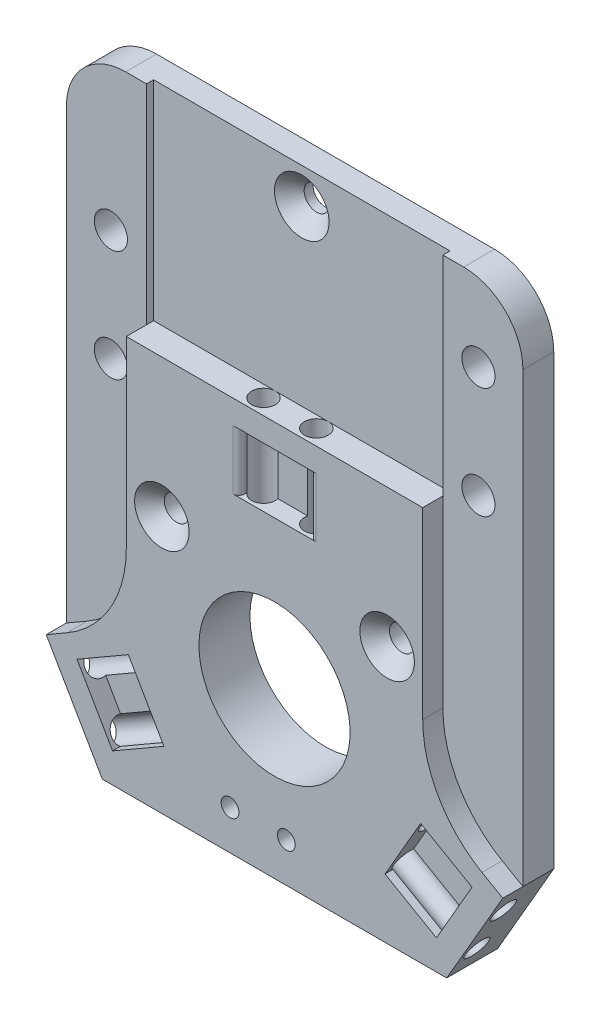
from build123d import *

# Parameters (mm, degrees)
BOSS_EXTRUDE1_DEPTH        = 2.6
BOSS_EXTRUDE1_DEPTH_BACK   = 6
FILLET1_R                  = 20
CUT_EXTRUDE1_DEPTH         = 5
SKETCH5_R                  = 2
CUT_EXTRUDE2_DEPTH         = 20
FILLET3_R                  = 1
CIRPATTERN1_COUNT          = 3
SKETCH6_R                  = 2.75
CUT_EXTRUDE3_DEPTH         = 56.475677209
BOSS_EXTRUDE2_DEPTH        = 4
SKETCH8_R                  = 2.1
CUT_EXTRUDE4_DEPTH         = 85.036841694
CHAMFER1_SIZE              = 2.5
SKETCH9_R                  = 1.5
CUT_EXTRUDE5_DEPTH         = 85.036841694
BOSS_EXTRUDE3_DEPTH        = 5.2
BOSS_EXTRUDE4_DEPTH        = 5.2
FILLET4_R                  = 10
SKETCH13_R                 = 7
CUT_EXTRUDE7_DEPTH         = 5
SKETCH14_W                 = 50
SKETCH14_H                 = 35.2
CUT_EXTRUDE8_DEPTH         = 1.2
F_5_6_5_6_DIAMETER_HOLE1_D = 5.6
SKETCH17_R                 = 12.75
CUT_EXTRUDE9_DEPTH         = 85.036841694


with BuildPart() as part:
    # Sketch3 → Boss-Extrude1 (new, two sides: drawn at the far end of the back side and taken through both)
    with BuildSketch(Plane.XY.offset(-BOSS_EXTRUDE1_DEPTH_BACK)):
        Polygon((-25, 39), (25, 39), (25, -3.511595657), (38.504425224, -11.308379196), (33.774990748, -19.5), (29.045556271, -27.691620804), (-29.045556271, -27.691620804), (-33.774990748, -19.5), (-38.504425224, -11.308379196), (-25, -3.511595657), align=None)
    extrude(amount=BOSS_EXTRUDE1_DEPTH + BOSS_EXTRUDE1_DEPTH_BACK)

    # Fillet1
    fillet1_edges = [part.edges().sort_by_distance(p)[0] for p in [
        (25, -3.511595657, -1.7),
        (-25, -3.511595657, -1.7),
    ]]
    fillet(fillet1_edges, radius=FILLET1_R)

    # Sketch4 → Cut-Extrude1 (cut, symmetric)
    with BuildSketch(Plane(origin=(0, 30, 0), x_dir=(1, 0, 0), z_dir=(0, 1, 0))):
        Polygon((5.114783638, 0.485216362), (-5.114783638, 0.485216362), (-6, -0.4), (-6, -2.6), (6, -2.6), (6, -0.4), align=None)
    cut_extrude1 = extrude(amount=CUT_EXTRUDE1_DEPTH, both=True, mode=Mode.SUBTRACT)

    # Sketch5 → Cut-Extrude2 (cut)
    with BuildSketch(Plane(origin=(0, 39, 0), x_dir=(1, 0, 0), z_dir=(0, 1, 0))):
        with Locations(Location((-4.458868953, 0, 0), (0, 0, 180))):
            Circle(SKETCH5_R)
        with Locations(Location((4.458868953, 0, 0), (0, 0, 180))):
            Circle(SKETCH5_R)
    cut_extrude2 = extrude(amount=-CUT_EXTRUDE2_DEPTH, mode=Mode.SUBTRACT)

    # Fillet3
    fillet3_edges = [part.edges().sort_by_distance(p)[0] for p in [
        (-6, 30, 2.6),
        (6, 30, 2.6),
    ]]
    fillet(fillet3_edges, radius=FILLET3_R)

    # CirPattern1: Cut-Extrude1, Cut-Extrude2 ×3 about axis
    cirpattern1_axis = Axis((0, 0, 0), (0, 0, 1))
    add([cut_extrude1.rotate(cirpattern1_axis, i * 360 / CIRPATTERN1_COUNT) for i in range(1, CIRPATTERN1_COUNT)], mode=Mode.SUBTRACT)
    add([cut_extrude2.rotate(cirpattern1_axis, i * 360 / CIRPATTERN1_COUNT) for i in range(1, CIRPATTERN1_COUNT)], mode=Mode.SUBTRACT)

    # Sketch6 → Cut-Extrude3 (cut, through all)
    with BuildSketch(Plane.XY.offset(2.6)):
        Circle(SKETCH6_R)
    extrude(amount=-CUT_EXTRUDE3_DEPTH, mode=Mode.SUBTRACT)

    # Sketch7 → Boss-Extrude2 (add)
    with BuildSketch(Plane(origin=(0, 0, -6), x_dir=(-1, 0, 0), z_dir=(0, 0, -1))):
        with BuildLine():
            Line((-25, 39), (25, 39))
            Line((25, 39), (25, 54))
            Line((25, 54), (3.986839478, 72.68387232))
            ThreePointArc((3.986839478, 72.68387232), (0, 74.2), (-3.986839478, 72.68387232))
            Line((-3.986839478, 72.68387232), (-25, 54))
            Line((-25, 54), (-25, 39))
        make_face()
    extrude(amount=-BOSS_EXTRUDE2_DEPTH)

    # Sketch8 → Cut-Extrude4 (cut, through all)
    with BuildSketch(Plane.XY.offset(2.6)):
        with Locations((-19, 15.7)):
            Circle(SKETCH8_R)
        with Locations((19, 15.7)):
            Circle(SKETCH8_R)
        with Locations((0, 68.2)):
            Circle(SKETCH8_R)
    extrude(amount=-CUT_EXTRUDE4_DEPTH, mode=Mode.SUBTRACT)

    # Chamfer1
    chamfer1_edges = [part.edges().sort_by_distance(p)[0] for p in [
        (-21.1, 15.7, 2.6),
        (16.9, 15.7, 2.6),
        (-2.1, 68.2, -2),
    ]]
    chamfer(chamfer1_edges, length=CHAMFER1_SIZE)

    # Sketch9 → Cut-Extrude5 (cut, through all)
    with BuildSketch(Plane(origin=(0, 0, -6), x_dir=(-1, 0, 0), z_dir=(0, 0, -1))):
        with Locations((7.5, -21.041620804)):
            Circle(SKETCH9_R)
        with Locations((-2, -21.041620804)):
            Circle(SKETCH9_R)
    extrude(amount=-CUT_EXTRUDE5_DEPTH, mode=Mode.SUBTRACT)

    # Sketch10 → Boss-Extrude3 (add)
    with BuildSketch(Plane(origin=(0, 0, -6), x_dir=(-1, 0, 0), z_dir=(0, 0, -1))):
        with BuildLine():
            Line((25, 8.035409726), (25, 54))
            Line((25, 54), (3.986839478, 72.68387232))
            ThreePointArc((3.986839478, 72.68387232), (2.132693846, 73.80817412), (0, 74.2))
            Line((0, 74.2), (38.504425224, 74.2))
            Line((38.504425224, 74.2), (38.504425224, -11.308379196))
            Line((38.504425224, -11.308379196), (35, -9.285098349))
            ThreePointArc((35, -9.285098349), (27.679491924, -1.964590274), (25, 8.035409726))
        make_face()
    extrude(amount=-BOSS_EXTRUDE3_DEPTH)

    # Sketch11 → Boss-Extrude4 (add)
    with BuildSketch(Plane(origin=(0, 0, -6), x_dir=(-1, 0, 0), z_dir=(0, 0, -1))):
        with BuildLine():
            Line((-38.504425224, -11.308379196), (-38.504425224, 74.2))
            Line((-38.504425224, 74.2), (0.121007206, 74.2))
            Line((0.121007206, 74.2), (-25, 54))
            Line((-25, 54), (-25, 8.035409726))
            ThreePointArc((-25, 8.035409726), (-27.679491924, -1.964590274), (-35, -9.285098349))
            Line((-35, -9.285098349), (-38.504425224, -11.308379196))
        make_face()
    extrude(amount=-BOSS_EXTRUDE4_DEPTH)

    # Fillet4
    fillet4_edges = [part.edges().sort_by_distance(p)[0] for p in [
        (-38.504425224, 74.2, -3.4),
        (38.504425224, 74.2, -3.4),
    ]]
    fillet(fillet4_edges, radius=FILLET4_R)

    # Sketch13 → Cut-Extrude7 (cut)
    with BuildSketch(Plane(origin=(0, 0, -6), x_dir=(-1, 0, 0), z_dir=(0, 0, -1))):
        Circle(SKETCH13_R)
    extrude(amount=-CUT_EXTRUDE7_DEPTH, mode=Mode.SUBTRACT)

    # Sketch14 → Cut-Extrude8 (cut)
    with BuildSketch(Plane.XY.offset(-0.8)):
        with Locations((0, 56.6)):
            Rectangle(SKETCH14_W, SKETCH14_H)
    extrude(amount=-CUT_EXTRUDE8_DEPTH, mode=Mode.SUBTRACT)

    # Ø5.6 (5.6) Diameter Hole1 (through all)
    with Locations(Plane.XY.offset(-0.8)):
        with Locations((-31, 49.8275), (-31, 31.0775), (31, 42.0775), (31, 60.8275)):
            Hole(F_5_6_5_6_DIAMETER_HOLE1_D / 2)

    # Sketch17 → Cut-Extrude9 (cut, through all)
    with BuildSketch(Plane(origin=(0, 0, -6), x_dir=(-1, 0, 0), z_dir=(0, 0, -1))):
        Circle(SKETCH17_R)
    extrude(amount=-CUT_EXTRUDE9_DEPTH, mode=Mode.SUBTRACT)


solid = part.part
